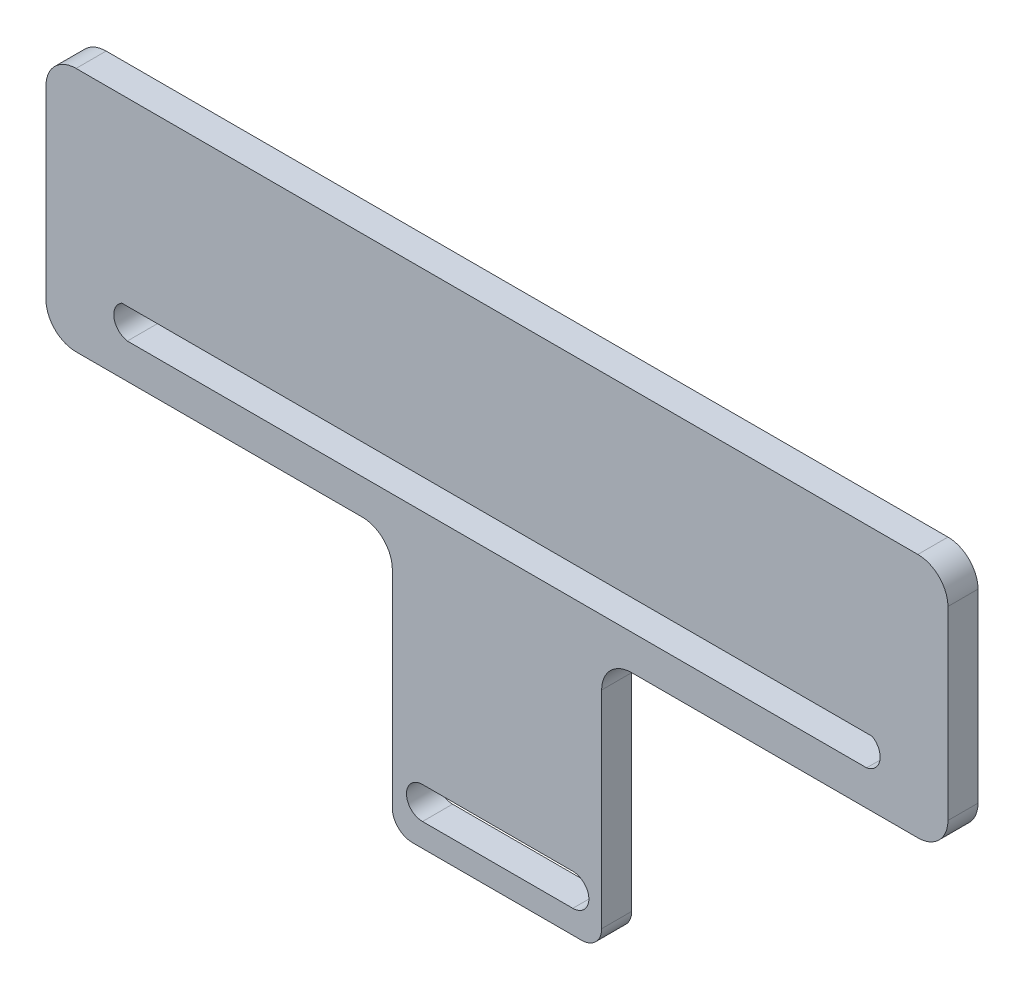
from build123d import *

# Parameters (mm, degrees)
EXTRUDE_2_DEPTH = 3


with BuildPart() as part:
    # 草图1 → 凸台-拉伸2 (new body)
    with BuildSketch(Plane.XY):
        with BuildLine():
            Line((-8.443741515, -3.928837448), (8.443741515, -3.928837448))
            ThreePointArc((8.443741515, -3.928837448), (9.857955078, -3.34305101), (10.443741515, -1.928837448))
            Line((10.443741515, -1.928837448), (10.443741515, 1.702434927))
            Line((10.443741515, 1.702434927), (10.443741515, 18.702434927))
            ThreePointArc((10.443741515, 18.702434927), (11.322421172, 20.823755271), (13.443741515, 21.702434927))
            Line((13.443741515, 21.702434927), (42, 21.702434927))
            ThreePointArc((42, 21.702434927), (44.121320344, 22.581114584), (45, 24.702434927))
            Line((45, 24.702434927), (45, 43.196509927))
            ThreePointArc((45, 43.196509927), (44.121320344, 45.31783027), (42, 46.196509927))
            Line((42, 46.196509927), (-42, 46.196509927))
            ThreePointArc((-42, 46.196509927), (-44.121320344, 45.31783027), (-45, 43.196509927))
            Line((-45, 43.196509927), (-45, 24.702434927))
            ThreePointArc((-45, 24.702434927), (-44.121320344, 22.581114584), (-42, 21.702434927))
            Line((-42, 21.702434927), (-13.443741515, 21.702434927))
            ThreePointArc((-13.443741515, 21.702434927), (-11.322421172, 20.823755271), (-10.443741515, 18.702434927))
            Line((-10.443741515, 18.702434927), (-10.443741515, 1.702434927))
            Line((-10.443741515, 1.702434927), (-10.443741515, -1.928837448))
            ThreePointArc((-10.443741515, -1.928837448), (-9.857955078, -3.34305101), (-8.443741515, -3.928837448))
        make_face()
        with BuildLine():
            Line((-7.430734656, 1.6), (7.569265344, 1.6))
            ThreePointArc((7.569265344, 1.6), (9.169265344, 0), (7.569265344, -1.6))
            Line((7.569265344, -1.6), (-7.430734656, -1.6))
            ThreePointArc((-7.430734656, -1.6), (-9.030734656, 0), (-7.430734656, 1.6))
        make_face(mode=Mode.SUBTRACT)
        with BuildLine():
            Line((36.883924739, 25.196509927), (-36.883924739, 25.196509927))
            ThreePointArc((-36.883924739, 25.196509927), (-38.209103575, 26.501622059), (-37.4430933, 28.196509927))
            Line((-37.4430933, 28.196509927), (37.4430933, 28.196509927))
            ThreePointArc((37.4430933, 28.196509927), (38.209103575, 26.501622059), (36.883924739, 25.196509927))
        make_face(mode=Mode.SUBTRACT)
    extrude(amount=EXTRUDE_2_DEPTH)


solid = part.part
